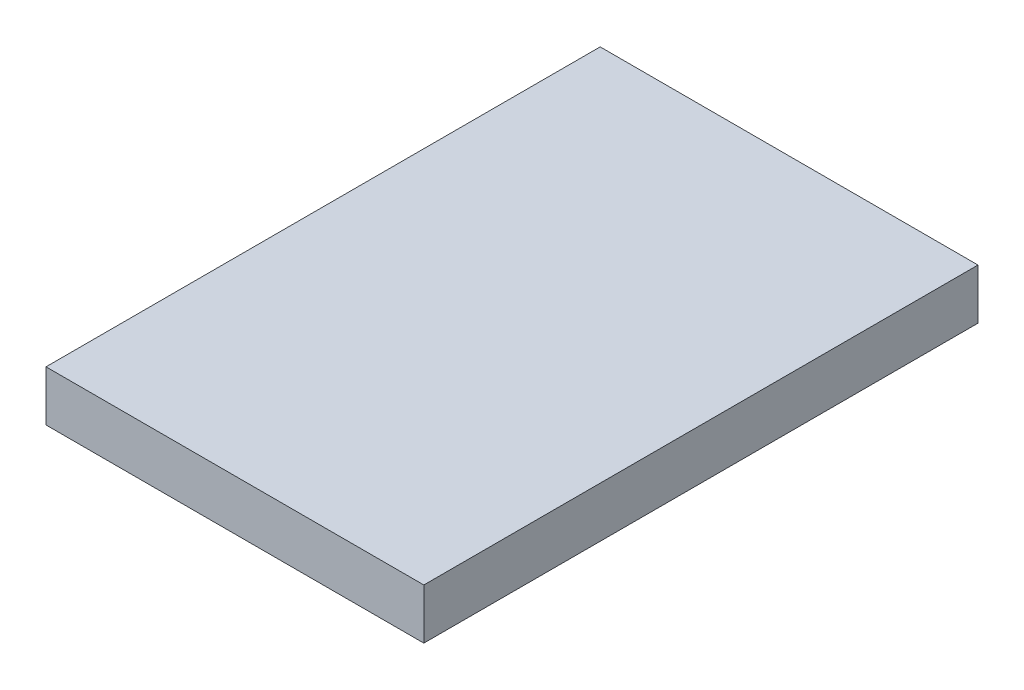
from build123d import *

# Parameters (mm, degrees)
SKETCH_1_W      = 75
SKETCH_1_H      = 110
EXTRUDE_1_DEPTH = 10


with BuildPart() as part:
    # Эскиз1 → Бобышка-Вытянуть1 (new body)
    with BuildSketch(Plane(origin=(0, 0, 0), x_dir=(1, 0, 0), z_dir=(0, 1, 0))):
        with Locations((37.5, 55)):
            Rectangle(SKETCH_1_W, SKETCH_1_H)
    extrude(amount=EXTRUDE_1_DEPTH)


solid = part.part
